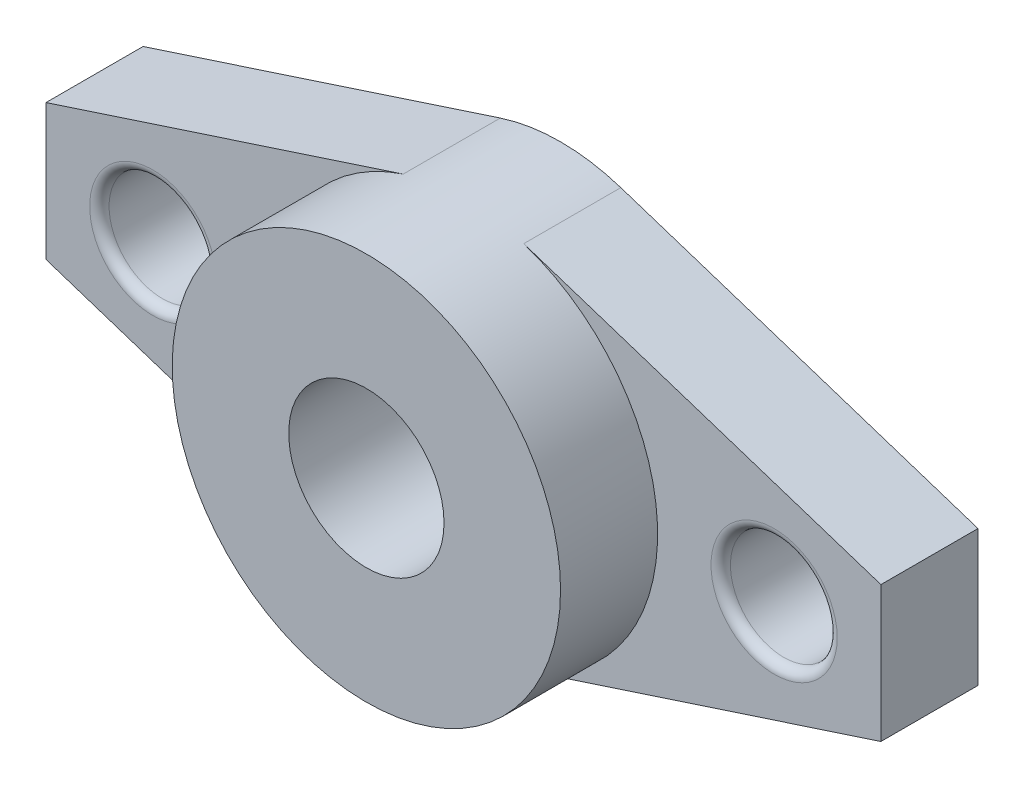
from build123d import *

# Parameters (mm, degrees)
SKETCH_1_R        = 2.75
EXTRUDE_1_DEPTH   = 5
EXTRUDE_1_2_DEPTH = 5
SKETCH_2_R        = 10
SKETCH_2_R_2      = 4
EXTRUDE_2_DEPTH   = 10
FILLET_2_R        = 0.5
FILLET_3_R        = 0.5


with BuildPart() as part:
    # 草图1 → 凸台-拉伸1 (new body)
    with BuildSketch(Plane.XY):
        with BuildLine():
            Line((21.5, 3.5), (3.10364576, 9.506176045))
            ThreePointArc((3.10364576, 9.506176045), (8.094333129, 5.872118119), (10, 0))
            ThreePointArc((10, 0), (8.094333129, -5.872118119), (3.10364576, -9.506176045))
            Line((3.10364576, -9.506176045), (21.5, -3.5))
            Line((21.5, -3.5), (21.5, 3.5))
        make_face()
        with Locations((16, 0)):
            Circle(SKETCH_1_R, mode=Mode.SUBTRACT)
    extrude(amount=EXTRUDE_1_DEPTH)



with BuildPart() as body_2:
    # 草图1 → Extrude 1 2 (new body)
    with BuildSketch(Plane.XY):
        with BuildLine():
            Line((-3.10364576, 9.506176045), (-21.5, 3.5))
            Line((-21.5, 3.5), (-21.5, -3.5))
            Line((-21.5, -3.5), (-3.10364576, -9.506176045))
            ThreePointArc((-3.10364576, -9.506176045), (-10, 0), (-3.10364576, 9.506176045))
        make_face()
        with Locations((-16, 0)):
            Circle(SKETCH_1_R, mode=Mode.SUBTRACT)
    extrude(amount=EXTRUDE_1_2_DEPTH)


with BuildPart() as part_1:
    add(part.part)

    add(body_2.part)  # 凸台-拉伸2 merges body 2
    # 草图2 → 凸台-拉伸2 (add)
    with BuildSketch(Plane.XY):
        with Locations(Location((0, 0, 0), (0, 0, 108.081202901))):
            Circle(SKETCH_2_R)
        Circle(SKETCH_2_R_2, mode=Mode.SUBTRACT)
    extrude(amount=EXTRUDE_2_DEPTH)

    # 圆角2
    fillet_2_edges = [part_1.edges().sort_by_distance(p)[0] for p in [
        (-18.75, 0, 5),
    ]]
    fillet(fillet_2_edges, radius=FILLET_2_R)

    # 圆角3
    fillet_3_edges = [part_1.edges().sort_by_distance(p)[0] for p in [
        (13.25, 0, 5),
    ]]
    fillet(fillet_3_edges, radius=FILLET_3_R)


solid = part_1.part
